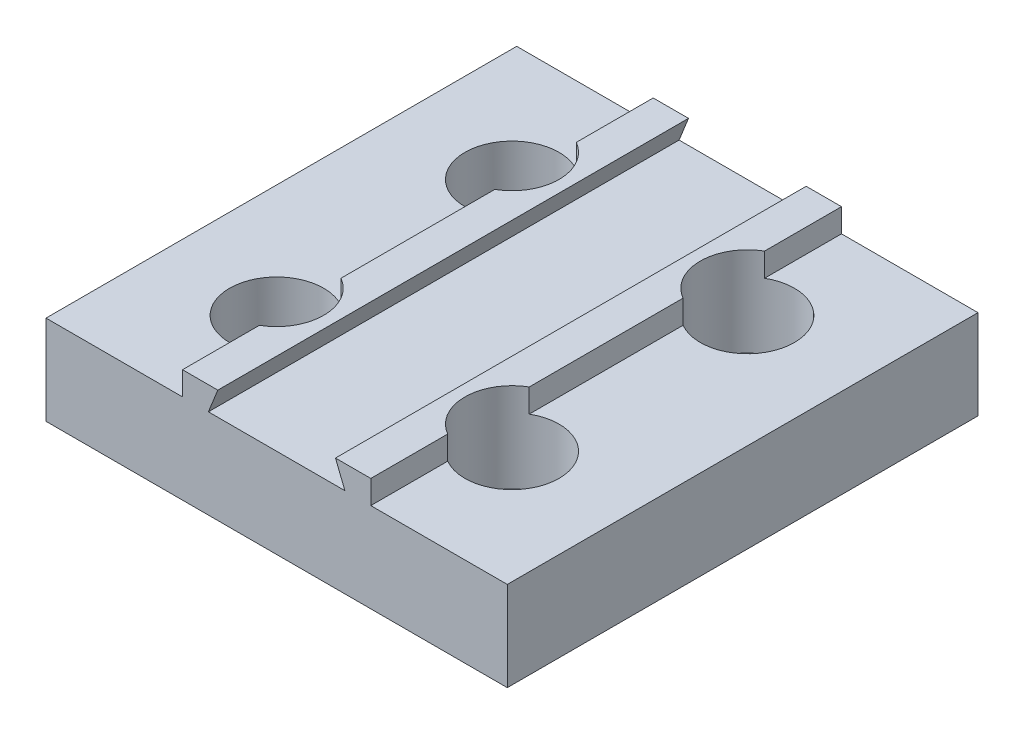
from build123d import *

# Parameters (mm, degrees)
SKETCH1_W                      = 20
SKETCH1_H                      = 50
BOSS_EXTRUDE1_DEPTH            = 12
CUT_EXTRUDE1_REACH             = 54.383
SKETCH4_W                      = 50
SKETCH4_H                      = 9.5
BOSS_EXTRUDE2_DEPTH            = 14.5
SKETCH5_W                      = 50
SKETCH5_H                      = 9.5
BOSS_EXTRUDE3_DEPTH            = 14.5
SKETCH10_R                     = 5
CUT_EXTRUDE4_DEPTH             = 7
CUT_EXTRUDE4_DIRECTION_2_REACH = 38.27
CUT_EXTRUDE5_REACH             = 38.27
SKETCH11_R                     = 2.25


with BuildPart() as part:
    # Sketch1 → Boss-Extrude1 (new body)
    with BuildSketch(Plane(origin=(0, 0, 0), x_dir=(1, 0, 0), z_dir=(0, 1, 0))):
        Rectangle(SKETCH1_W, SKETCH1_H)
    extrude(amount=BOSS_EXTRUDE1_DEPTH)

    # Sketch2 → Cut-Extrude1 (cut, up to next)
    with BuildSketch(Plane.XY.offset(25), mode=Mode.PRIVATE) as cut_extrude1_sk1:
        Polygon((0, 9.5), (7.25, 9.5), (6.25, 12), (0, 12), (-6.25, 12), (-7.25, 9.5), align=None)
    cut_extrude1_tool1 = extrude(cut_extrude1_sk1.sketch, amount=-CUT_EXTRUDE1_REACH, mode=Mode.PRIVATE) & part.part
    add(cut_extrude1_tool1.solids().sort_by_distance((0, 10.719136, 25))[0], mode=Mode.SUBTRACT)

    # Sketch4 → Boss-Extrude2 (add)
    with BuildSketch(Plane.ZY.offset(10)):
        with Locations((0, 4.75)):
            Rectangle(SKETCH4_W, SKETCH4_H)
    extrude(amount=BOSS_EXTRUDE2_DEPTH)

    # Sketch5 → Boss-Extrude3 (add)
    with BuildSketch(Plane(origin=(10, 0, 0), x_dir=(0, 0, -1), z_dir=(1, 0, 0))):
        with Locations((0, 4.75)):
            Rectangle(SKETCH5_W, SKETCH5_H)
    extrude(amount=BOSS_EXTRUDE3_DEPTH)

    # Sketch10 → Cut-Extrude4 (cut)
    with BuildSketch(Plane(origin=(0, 9.5, 0), x_dir=(1, 0, 0), z_dir=(0, 1, 0))):
        with Locations(Location((-12.5, 12.5, 0), (0, 0, 60))):
            Circle(SKETCH10_R)
        with Locations(Location((12.5, 12.5, 0), (0, 0, 120))):
            Circle(SKETCH10_R)
        with Locations(Location((-12.5, -12.5, 0), (0, 0, 60))):
            Circle(SKETCH10_R)
        with Locations(Location((12.5, -12.5, 0), (0, 0, 120))):
            Circle(SKETCH10_R)
    extrude(amount=-CUT_EXTRUDE4_DEPTH, mode=Mode.SUBTRACT)

    # Sketch10 → Cut-Extrude4 direction 2 (cut, up to next)
    with BuildSketch(Plane(origin=(0, 9.5, 0), x_dir=(1, 0, 0), z_dir=(0, 1, 0)), mode=Mode.PRIVATE) as cut_extrude4_direction_2_sk1:
        with Locations(Location((-12.5, 12.5, 0), (0, 0, 60))):
            Circle(SKETCH10_R)
    cut_extrude4_direction_2_tool1 = extrude(cut_extrude4_direction_2_sk1.sketch, amount=CUT_EXTRUDE4_DIRECTION_2_REACH, mode=Mode.PRIVATE) & part.part
    # Sketch10 → Cut-Extrude4 direction 2 (cut, up to next)
    with BuildSketch(Plane(origin=(0, 9.5, 0), x_dir=(1, 0, 0), z_dir=(0, 1, 0)), mode=Mode.PRIVATE) as cut_extrude4_direction_2_sk2:
        with Locations(Location((12.5, 12.5, 0), (0, 0, 120))):
            Circle(SKETCH10_R)
    cut_extrude4_direction_2_tool2 = extrude(cut_extrude4_direction_2_sk2.sketch, amount=CUT_EXTRUDE4_DIRECTION_2_REACH, mode=Mode.PRIVATE) & part.part
    # Sketch10 → Cut-Extrude4 direction 2 (cut, up to next)
    with BuildSketch(Plane(origin=(0, 9.5, 0), x_dir=(1, 0, 0), z_dir=(0, 1, 0)), mode=Mode.PRIVATE) as cut_extrude4_direction_2_sk3:
        with Locations(Location((-12.5, -12.5, 0), (0, 0, 60))):
            Circle(SKETCH10_R)
    cut_extrude4_direction_2_tool3 = extrude(cut_extrude4_direction_2_sk3.sketch, amount=CUT_EXTRUDE4_DIRECTION_2_REACH, mode=Mode.PRIVATE) & part.part
    # Sketch10 → Cut-Extrude4 direction 2 (cut, up to next)
    with BuildSketch(Plane(origin=(0, 9.5, 0), x_dir=(1, 0, 0), z_dir=(0, 1, 0)), mode=Mode.PRIVATE) as cut_extrude4_direction_2_sk4:
        with Locations(Location((12.5, -12.5, 0), (0, 0, 120))):
            Circle(SKETCH10_R)
    cut_extrude4_direction_2_tool4 = extrude(cut_extrude4_direction_2_sk4.sketch, amount=CUT_EXTRUDE4_DIRECTION_2_REACH, mode=Mode.PRIVATE) & part.part
    add(cut_extrude4_direction_2_tool1.solids().sort_by_distance((-12.5, 9.5, -12.5))[0], mode=Mode.SUBTRACT)
    add(cut_extrude4_direction_2_tool2.solids().sort_by_distance((12.5, 9.5, -12.5))[0], mode=Mode.SUBTRACT)
    add(cut_extrude4_direction_2_tool3.solids().sort_by_distance((-12.5, 9.5, 12.5))[0], mode=Mode.SUBTRACT)
    add(cut_extrude4_direction_2_tool4.solids().sort_by_distance((12.5, 9.5, 12.5))[0], mode=Mode.SUBTRACT)

    # Sketch11 → Cut-Extrude5 (cut, up to next)
    with BuildSketch(Plane(origin=(0, 2.5, 0), x_dir=(1, 0, 0), z_dir=(0, 1, 0)), mode=Mode.PRIVATE) as cut_extrude5_sk1:
        with Locations(Location((-12.5, 12.5, 0), (0, 0, 270))):
            Circle(SKETCH11_R)
    cut_extrude5_tool1 = extrude(cut_extrude5_sk1.sketch, amount=-CUT_EXTRUDE5_REACH, mode=Mode.PRIVATE) & part.part
    # Sketch11 → Cut-Extrude5 (cut, up to next)
    with BuildSketch(Plane(origin=(0, 2.5, 0), x_dir=(1, 0, 0), z_dir=(0, 1, 0)), mode=Mode.PRIVATE) as cut_extrude5_sk2:
        with Locations(Location((12.5, 12.5, 0), (0, 0, 270))):
            Circle(SKETCH11_R)
    cut_extrude5_tool2 = extrude(cut_extrude5_sk2.sketch, amount=-CUT_EXTRUDE5_REACH, mode=Mode.PRIVATE) & part.part
    # Sketch11 → Cut-Extrude5 (cut, up to next)
    with BuildSketch(Plane(origin=(0, 2.5, 0), x_dir=(1, 0, 0), z_dir=(0, 1, 0)), mode=Mode.PRIVATE) as cut_extrude5_sk3:
        with Locations(Location((-12.5, -12.5, 0), (0, 0, 270))):
            Circle(SKETCH11_R)
    cut_extrude5_tool3 = extrude(cut_extrude5_sk3.sketch, amount=-CUT_EXTRUDE5_REACH, mode=Mode.PRIVATE) & part.part
    # Sketch11 → Cut-Extrude5 (cut, up to next)
    with BuildSketch(Plane(origin=(0, 2.5, 0), x_dir=(1, 0, 0), z_dir=(0, 1, 0)), mode=Mode.PRIVATE) as cut_extrude5_sk4:
        with Locations(Location((12.5, -12.5, 0), (0, 0, 270))):
            Circle(SKETCH11_R)
    cut_extrude5_tool4 = extrude(cut_extrude5_sk4.sketch, amount=-CUT_EXTRUDE5_REACH, mode=Mode.PRIVATE) & part.part
    add(cut_extrude5_tool1.solids().sort_by_distance((-12.5, 2.5, -12.5))[0], mode=Mode.SUBTRACT)
    add(cut_extrude5_tool2.solids().sort_by_distance((12.5, 2.5, -12.5))[0], mode=Mode.SUBTRACT)
    add(cut_extrude5_tool3.solids().sort_by_distance((-12.5, 2.5, 12.5))[0], mode=Mode.SUBTRACT)
    add(cut_extrude5_tool4.solids().sort_by_distance((12.5, 2.5, 12.5))[0], mode=Mode.SUBTRACT)


solid = part.part
